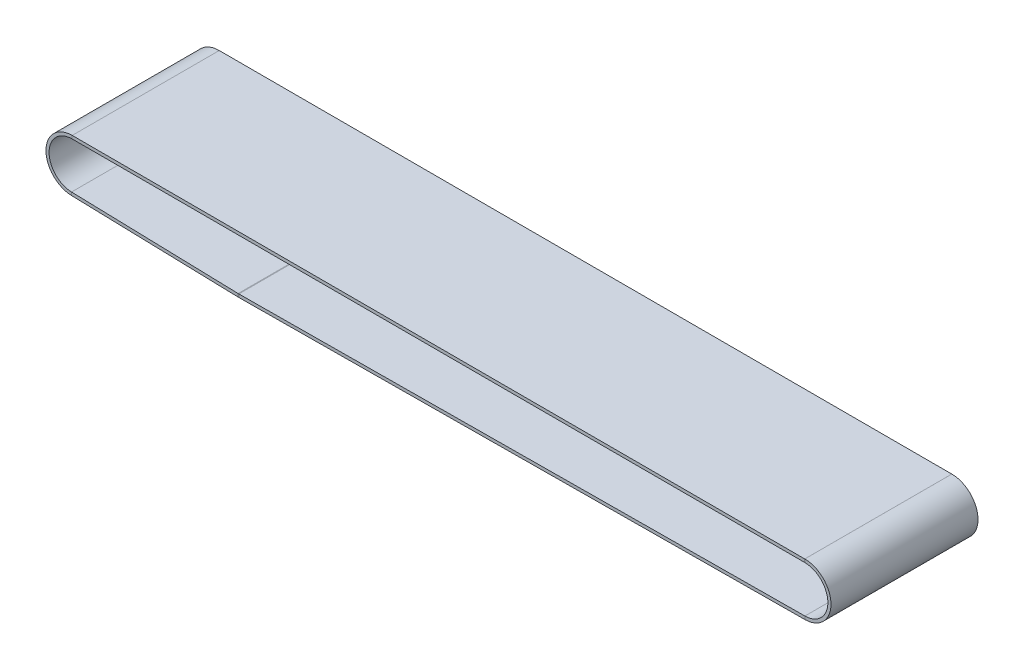
from build123d import *

# Parameters (mm, degrees)
SKETCH3_W = 143
SKETCH3_H = 3


with BuildPart() as part:
    # Sweep1: sweep along a path in Sketch2
    with BuildLine(Plane.XY) as sweep1_path:
        Line((0.163473618, -22.499406134), (-550.378627812, -26.499472119))
        ThreePointArc((-550.378627812, -26.499472119), (-550.729038327, -26.498948316), (-551.079385884, -26.492285445))
        Line((-551.079385884, -26.492285445), (-713.082908724, -21.991321125))
        ThreePointArc((-713.082908724, -21.991321125), (-734.955748657, 0.82036416), (-712.442239111, 22.999994459))
        Line((-712.442239111, 22.999994459), (0.0157904, 22.499994459))
        ThreePointArc((0.0157904, 22.499994459), (22.499878829, 0.073842195), (0.163473618, -22.499406134))
    # Sketch3 → Sweep1 (sweep)
    with BuildSketch(Plane(origin=(0, 0, 0), x_dir=(0, 0, -1), z_dir=(1, 0, 0))):
        with Locations((0, 24.000005541)):
            Rectangle(SKETCH3_W, SKETCH3_H)
    sweep(path=sweep1_path.line)


solid = part.part
